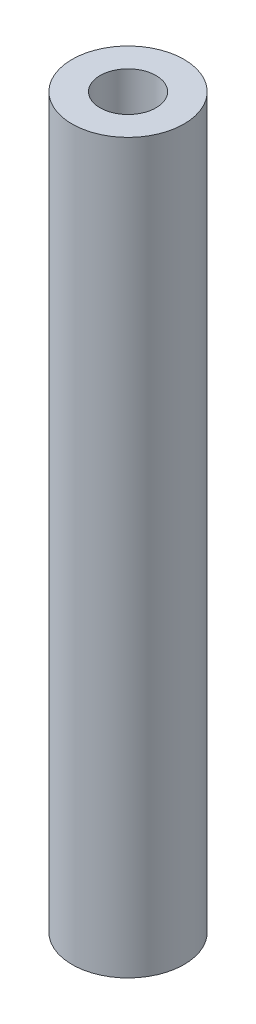
from build123d import *

# Parameters (mm, degrees)
ESQUISSE1_W             = 5
ESQUISSE1_H             = 65
ESQUISSE2_R             = 2.5
ENL_V_MAT_EXTRU_1_DEPTH = 66.383484153


with BuildPart() as part:
    # Esquisse1 → Révol.-Mince1 (revolve)
    with BuildSketch(Plane.XY, mode=Mode.PRIVATE) as r_vol_mince1_sk:
        with Locations((-2.5, 32.5)):
            Rectangle(ESQUISSE1_W, ESQUISSE1_H)
    revolve(r_vol_mince1_sk.sketch.rotate(Axis((0, 0, 0), (0, 1, 0)), 270), axis=Axis((0, 0, 0), (0, 1, 0)))

    # Esquisse2 → Enlèv. mat.-Extru.1 (cut, through all)
    with BuildSketch(Plane(origin=(0, 65, 0), x_dir=(1, 0, 0), z_dir=(0, 1, 0))):
        with Locations(Location((0, 0, 0), (0, 0, 270))):
            Circle(ESQUISSE2_R)
    extrude(amount=-ENL_V_MAT_EXTRU_1_DEPTH, mode=Mode.SUBTRACT)


solid = part.part
